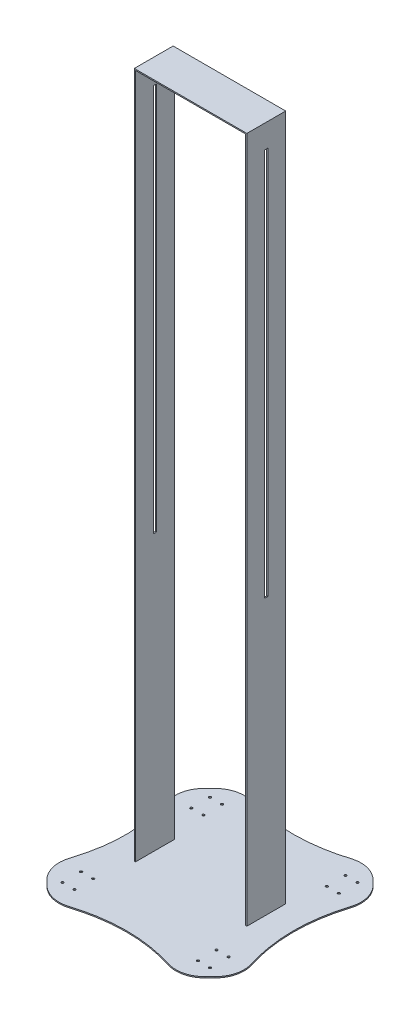
from build123d import *

# Parameters (mm, degrees)
SKETCH1_W           = 290
SKETCH1_H           = 3
BOSS_EXTRUDE1_DEPTH = 100
SKETCH2_W           = 3
SKETCH2_H           = 100
BOSS_EXTRUDE2_DEPTH = 1765.8
SKETCH5_W           = 8
SKETCH5_H           = 1000
CUT_EXTRUDE1_DEPTH  = 150
BOSS_EXTRUDE3_DEPTH = 3
FILLET1_R           = 75
SKETCH7_R           = 3
CUT_EXTRUDE2_DEPTH  = 10


with BuildPart() as part:
    # Sketch1 → Boss-Extrude1 (new body)
    with BuildSketch(Plane.XY):
        Rectangle(SKETCH1_W, SKETCH1_H)
    extrude(amount=-BOSS_EXTRUDE1_DEPTH)

    # Sketch2 → Boss-Extrude2 (add)
    with BuildSketch(Plane.XZ.offset(1.5)):
        with Locations((-143.5, -50)):
            Rectangle(SKETCH2_W, SKETCH2_H)
        with Locations((143.5, -50)):
            Rectangle(SKETCH2_W, SKETCH2_H)
    extrude(amount=BOSS_EXTRUDE2_DEPTH)

    # Sketch5 → Cut-Extrude1 (cut, symmetric)
    with BuildSketch(Plane(origin=(0, 0, 0), x_dir=(0, 0, -1), z_dir=(1, 0, 0))):
        with Locations((50, -558.5)):
            Rectangle(SKETCH5_W, SKETCH5_H)
    extrude(amount=CUT_EXTRUDE1_DEPTH, both=True, mode=Mode.SUBTRACT)

    # Sketch6 → Boss-Extrude3 (add)
    with BuildSketch(Plane.XZ.offset(1767.3)):
        with BuildLine():
            Line((-250, 120), (-170, 200))
            add(Edge.make_bspline(
                [(-170, 200), (0, 130), (170, 200)],
                knots=[0, 0, 0, 1, 1, 1], degree=2))
            Line((170, 200), (250, 120))
            add(Edge.make_bspline(
                [(250, 120), (180, -50), (250, -220)],
                knots=[0, 0, 0, 1, 1, 1], degree=2))
            Line((250, -220), (170, -300))
            add(Edge.make_bspline(
                [(-170, -300), (0, -230), (170, -300)],
                knots=[0, 0, 0, 1, 1, 1], degree=2))
            Line((-170, -300), (-250, -220))
            add(Edge.make_bspline(
                [(-250, 120), (-201.61826543, -7.179894106), (-205.048401237, -92.820105894), (-250, -220)],
                knots=[0, 0, 0, 0, 1, 1, 1, 1], degree=3))
        make_face()
    extrude(amount=BOSS_EXTRUDE3_DEPTH)

    # Fillet1
    fillet1_edges = [part.edges().sort_by_distance(p)[0] for p in [
        (250, -1768.8, 120),
        (-170, -1768.8, 200),
        (-250, -1768.8, 120),
        (-250, -1768.8, -220),
        (-170, -1768.8, -300),
        (170, -1768.8, -300),
        (250, -1768.8, -220),
        (170, -1768.8, 200),
    ]]
    fillet(fillet1_edges, radius=FILLET1_R)

    # Sketch7 → Cut-Extrude2 (cut)
    with BuildSketch(Plane.XZ.offset(1770.3)):
        with Locations(Location((-190, 140, 0), (0, 0, 270))):
            Circle(SKETCH7_R)
        with Locations(Location((-159, 140, 0), (0, 0, 270))):
            Circle(SKETCH7_R)
        with Locations(Location((-190, 92, 0), (0, 0, 270))):
            Circle(SKETCH7_R)
        with Locations(Location((-159, 92, 0), (0, 0, 270))):
            Circle(SKETCH7_R)
        with Locations(Location((190, 92, 0), (0, 0, 90))):
            Circle(SKETCH7_R)
        with Locations(Location((159, 92, 0), (0, 0, 90))):
            Circle(SKETCH7_R)
        with Locations(Location((159, 140, 0), (0, 0, 90))):
            Circle(SKETCH7_R)
        with Locations(Location((190, 140, 0), (0, 0, 90))):
            Circle(SKETCH7_R)
        with Locations(Location((159, -192, 0), (0, 0, 270))):
            Circle(SKETCH7_R)
        with Locations(Location((190, -192, 0), (0, 0, 270))):
            Circle(SKETCH7_R)
        with Locations(Location((190, -240, 0), (0, 0, 270))):
            Circle(SKETCH7_R)
        with Locations(Location((159, -240, 0), (0, 0, 270))):
            Circle(SKETCH7_R)
        with Locations(Location((-190, -192, 0), (0, 0, 90))):
            Circle(SKETCH7_R)
        with Locations(Location((-159, -192, 0), (0, 0, 90))):
            Circle(SKETCH7_R)
        with Locations(Location((-159, -240, 0), (0, 0, 90))):
            Circle(SKETCH7_R)
        with Locations(Location((-190, -240, 0), (0, 0, 90))):
            Circle(SKETCH7_R)
    extrude(amount=-CUT_EXTRUDE2_DEPTH, mode=Mode.SUBTRACT)


solid = part.part
